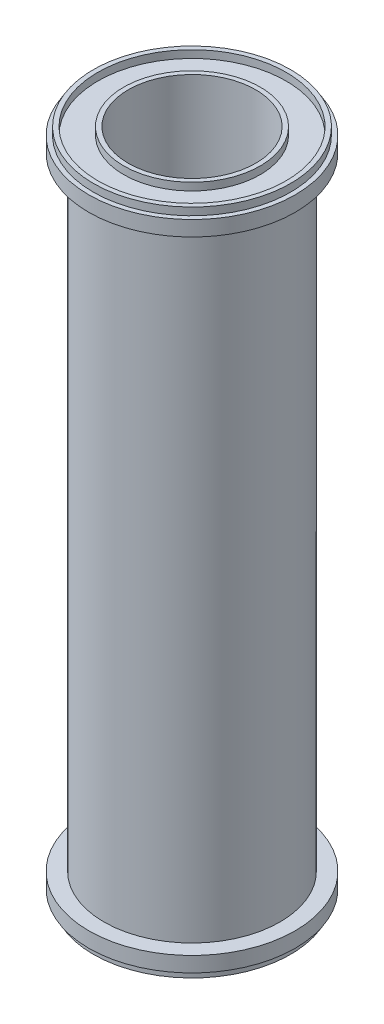
from build123d import *


with BuildPart() as part:
    # Sketch1 → Revolve1 (revolve)
    with BuildSketch(Plane.YZ):
        Polygon((22, 4.5), (22, 4.2), (-22, 4.2), (-22, 4.5), (-21.5, 4.5), (-21.5, 6.2), (-22, 6.2), (-22, 6.5), (-21.5, 6.5), (-21.5, 6.8), (-20.5, 6.8), (-20.5, 5.8), (20.5, 5.8), (20.5, 6.8), (21.5, 6.8), (21.5, 6.5), (22, 6.5), (22, 6.2), (21.5, 6.2), (21.5, 4.5), align=None)
    revolve(axis=Axis((0, 0, 0), (0, 1, 0)))


solid = part.part
